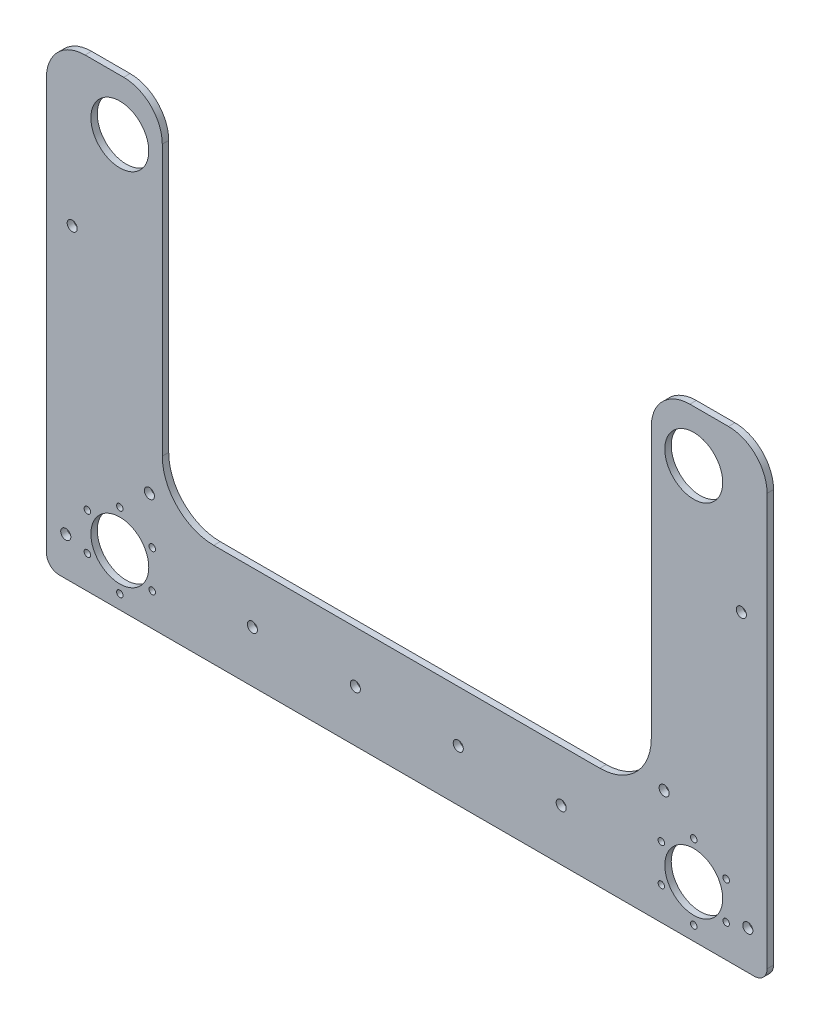
from build123d import *

# Parameters (mm, degrees)
SKETCH1_R           = 14.2875
SKETCH1_R_2         = 1.6002
SKETCH1_R_3         = 2.4892
BOSS_EXTRUDE3_DEPTH = 3.175
SKETCH2_W           = 355.6
SKETCH2_H           = 19.05
CUT_EXTRUDE1_DEPTH  = 290.621961572
FILLET1_R           = 19.05


with BuildPart() as part:
    # Sketch1 → Boss-Extrude3 (new body)
    with BuildSketch(Plane.XY):
        with BuildLine():
            Line((120.65, -152.4), (120.65, -6.35))
            Line((120.65, -6.35), (120.65, 6.35))
            ThreePointArc((120.65, 6.35), (124.369743879, 15.330256121), (133.35, 19.05))
            Line((133.35, 19.05), (165.1, 19.05))
            ThreePointArc((165.1, 19.05), (174.080256121, 15.330256121), (177.8, 6.35))
            Line((177.8, 6.35), (177.8, -6.35))
            Line((177.8, -6.35), (177.8, -222.25))
            ThreePointArc((177.8, -222.25), (175.940128061, -226.740128061), (171.45, -228.6))
            Line((171.45, -228.6), (12.7, -228.6))
            Line((12.7, -228.6), (-12.7, -228.6))
            Line((-12.7, -228.6), (-171.45, -228.6))
            ThreePointArc((-171.45, -228.6), (-175.940128061, -226.740128061), (-177.8, -222.25))
            Line((-177.8, -222.25), (-177.8, -6.35))
            Line((-177.8, -6.35), (-177.8, 6.35))
            ThreePointArc((-177.8, 6.35), (-174.080256121, 15.330256121), (-165.1, 19.05))
            Line((-165.1, 19.05), (-133.35, 19.05))
            ThreePointArc((-133.35, 19.05), (-124.369743879, 15.330256121), (-120.65, 6.35))
            Line((-120.65, 6.35), (-120.65, -6.35))
            Line((-120.65, -6.35), (-120.65, -152.4))
            ThreePointArc((-120.65, -152.4), (-113.210512242, -170.360512242), (-95.25, -177.8))
            Line((-95.25, -177.8), (-12.7, -177.8))
            Line((-12.7, -177.8), (12.7, -177.8))
            Line((12.7, -177.8), (95.25, -177.8))
            ThreePointArc((95.25, -177.8), (113.210512242, -170.360512242), (120.65, -152.4))
        make_face()
        with Locations((141.605, -25.4)):
            Circle(SKETCH1_R, mode=Mode.SUBTRACT)
        with Locations(Location((-141.605, -25.4, 0), (0, 0, 180))):
            Circle(SKETCH1_R, mode=Mode.SUBTRACT)
        with Locations((-141.605, -203.2)):
            Circle(SKETCH1_R, mode=Mode.SUBTRACT)
        with Locations((-141.605, -184.722481985)):
            Circle(SKETCH1_R_2, mode=Mode.SUBTRACT)
        with Locations((-125.603, -193.961240992)):
            Circle(SKETCH1_R_2, mode=Mode.SUBTRACT)
        with Locations((-125.603, -212.438759008)):
            Circle(SKETCH1_R_2, mode=Mode.SUBTRACT)
        with Locations((-141.605, -221.677518015)):
            Circle(SKETCH1_R_2, mode=Mode.SUBTRACT)
        with Locations((-157.607, -212.438759008)):
            Circle(SKETCH1_R_2, mode=Mode.SUBTRACT)
        with Locations((-157.607, -193.961240992)):
            Circle(SKETCH1_R_2, mode=Mode.SUBTRACT)
        with Locations(Location((157.607, -212.438759008, 0), (0, 0, 180))):
            Circle(SKETCH1_R_2, mode=Mode.SUBTRACT)
        with Locations(Location((157.607, -193.961240992, 0), (0, 0, 180))):
            Circle(SKETCH1_R_2, mode=Mode.SUBTRACT)
        with Locations(Location((141.605, -184.722481985, 0), (0, 0, 180))):
            Circle(SKETCH1_R_2, mode=Mode.SUBTRACT)
        with Locations(Location((125.603, -193.961240992, 0), (0, 0, 180))):
            Circle(SKETCH1_R_2, mode=Mode.SUBTRACT)
        with Locations(Location((125.603, -212.438759008, 0), (0, 0, 180))):
            Circle(SKETCH1_R_2, mode=Mode.SUBTRACT)
        with Locations(Location((141.605, -221.677518015, 0), (0, 0, 180))):
            Circle(SKETCH1_R_2, mode=Mode.SUBTRACT)
        with Locations(Location((141.605, -203.2, 0), (0, 0, 180))):
            Circle(SKETCH1_R, mode=Mode.SUBTRACT)
        with Locations((-76.2, -203.2)):
            Circle(SKETCH1_R_3, mode=Mode.SUBTRACT)
        with Locations(Location((76.2, -203.2, 0), (0, 0, 180))):
            Circle(SKETCH1_R_3, mode=Mode.SUBTRACT)
        with Locations((-25.4, -203.2)):
            Circle(SKETCH1_R_3, mode=Mode.SUBTRACT)
        with Locations((-127, -171.45)):
            Circle(SKETCH1_R_3, mode=Mode.SUBTRACT)
        with Locations((-149.225, 6.35)):
            Circle(SKETCH1_R_3, mode=Mode.SUBTRACT)
        with Locations(Location((127, -171.45, 0), (0, 0, 180))):
            Circle(SKETCH1_R_3, mode=Mode.SUBTRACT)
        with Locations(Location((149.225, 6.35, 0), (0, 0, 180))):
            Circle(SKETCH1_R_3, mode=Mode.SUBTRACT)
        with Locations((-168.275, -209.55)):
            Circle(SKETCH1_R_3, mode=Mode.SUBTRACT)
        with Locations(Location((168.275, -209.55, 0), (0, 0, 180))):
            Circle(SKETCH1_R_3, mode=Mode.SUBTRACT)
        with Locations((-165.1, -76.2)):
            Circle(SKETCH1_R_3, mode=Mode.SUBTRACT)
        with Locations(Location((165.1, -76.2, 0), (0, 0, 180))):
            Circle(SKETCH1_R_3, mode=Mode.SUBTRACT)
        with Locations(Location((25.4, -203.2, 0), (0, 0, 180))):
            Circle(SKETCH1_R_3, mode=Mode.SUBTRACT)
    extrude(amount=BOSS_EXTRUDE3_DEPTH)

    # Sketch2 → Cut-Extrude1 (cut, through all)
    with BuildSketch(Plane.XY.offset(3.175)):
        with Locations((0, 9.525)):
            Rectangle(SKETCH2_W, SKETCH2_H)
    extrude(amount=-CUT_EXTRUDE1_DEPTH, mode=Mode.SUBTRACT)

    # Fillet1
    fillet1_edges = [part.edges().sort_by_distance(p)[0] for p in [
        (-177.8, 0, 1.5875),
        (120.65, 0, 1.5875),
        (177.8, 0, 1.5875),
        (-120.65, 0, 1.5875),
    ]]
    fillet(fillet1_edges, radius=FILLET1_R)


solid = part.part
